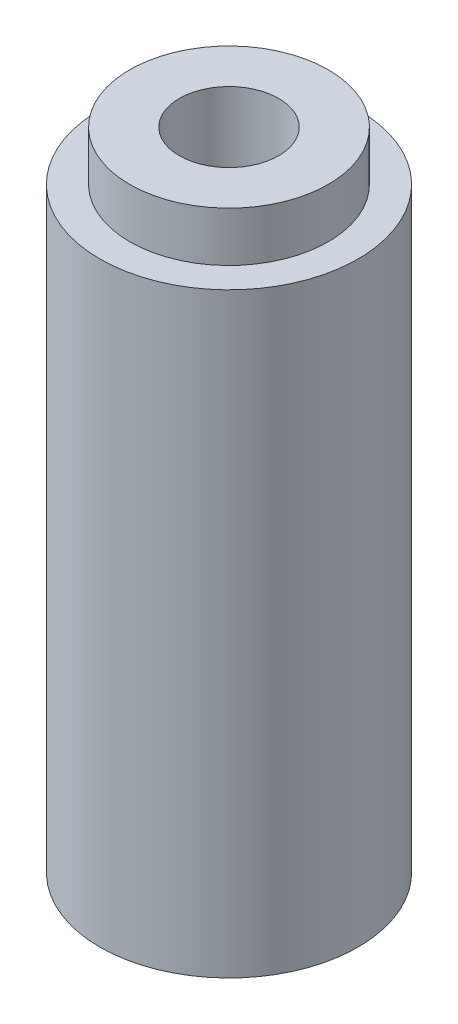
from build123d import *

# Parameters (mm, degrees)
SKETCH_1_R      = 2.6
SKETCH_1_R_2    = 1
EXTRUDE_1_DEPTH = 12
SKETCH_3_R      = 2
SKETCH_3_R_2    = 1
EXTRUDE_2_DEPTH = 1


with BuildPart() as part:
    # Эскиз1 → Бобышка-Вытянуть1 (new body)
    with BuildSketch(Plane(origin=(0, 0, 0), x_dir=(1, 0, 0), z_dir=(0, 1, 0))):
        with Locations(Location((0, 0, 0), (0, 0, 270))):
            Circle(SKETCH_1_R)
        with Locations(Location((0, 0, 0), (0, 0, 270))):
            Circle(SKETCH_1_R_2, mode=Mode.SUBTRACT)
    extrude(amount=EXTRUDE_1_DEPTH)

    # Эскиз3 → Бобышка-Вытянуть2 (add)
    with BuildSketch(Plane(origin=(0, 12, 0), x_dir=(1, 0, 0), z_dir=(0, 1, 0))):
        with Locations(Location((0, 0, 0), (0, 0, 270))):
            Circle(SKETCH_3_R)
        with Locations(Location((0, 0, 0), (0, 0, 270))):
            Circle(SKETCH_3_R_2, mode=Mode.SUBTRACT)
    extrude(amount=EXTRUDE_2_DEPTH)


solid = part.part
